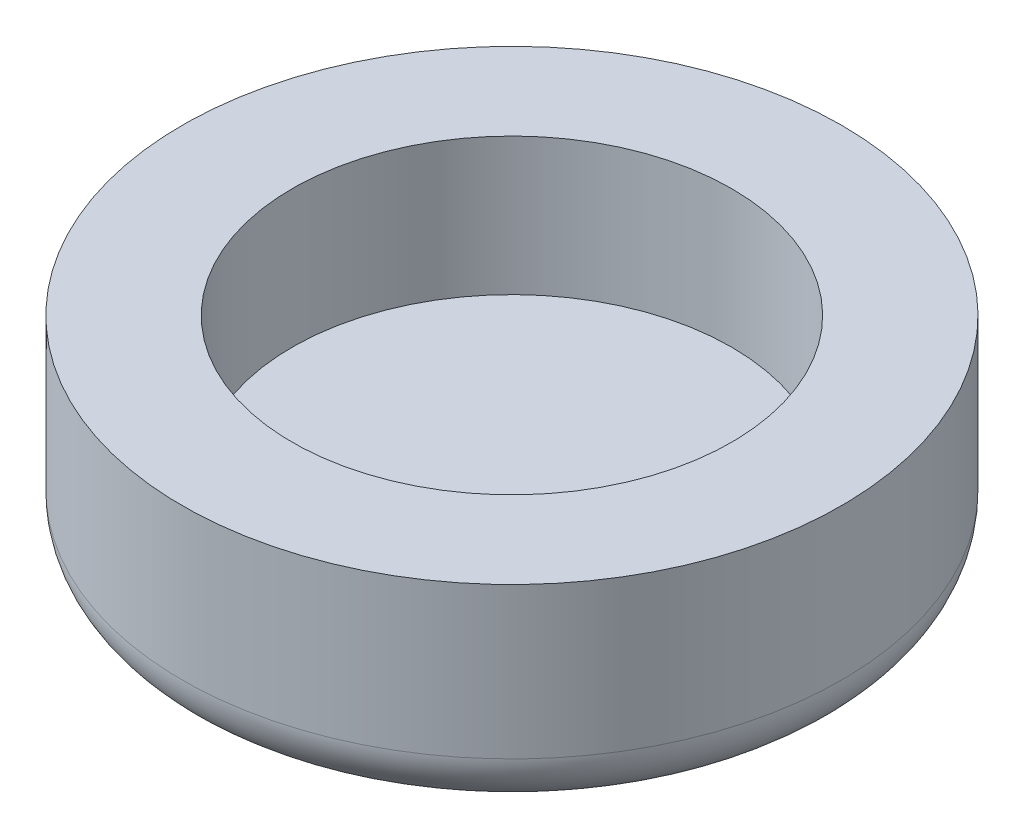
from build123d import *

# Parameters (mm, degrees)
FILLET1_R = 0.4


with BuildPart() as part:
    # Sketch1 → Revolve1 (revolve)
    with BuildSketch(Plane.XY, mode=Mode.PRIVATE) as revolve1_sk:
        Polygon((0, 0), (2.4, 0), (2.4, 1.5), (1.6, 1.5), (1.6, 0.5), (0, 0.5), align=None)
    revolve(revolve1_sk.sketch.rotate(Axis((0, 0, 0), (0, 1, 0)), 90), axis=Axis((0, 0, 0), (0, 1, 0)))

    # Fillet1
    fillet1_edges = [part.edges().sort_by_distance(p)[0] for p in [
        (0, 0, 2.4),
    ]]
    fillet(fillet1_edges, radius=FILLET1_R)


solid = part.part
